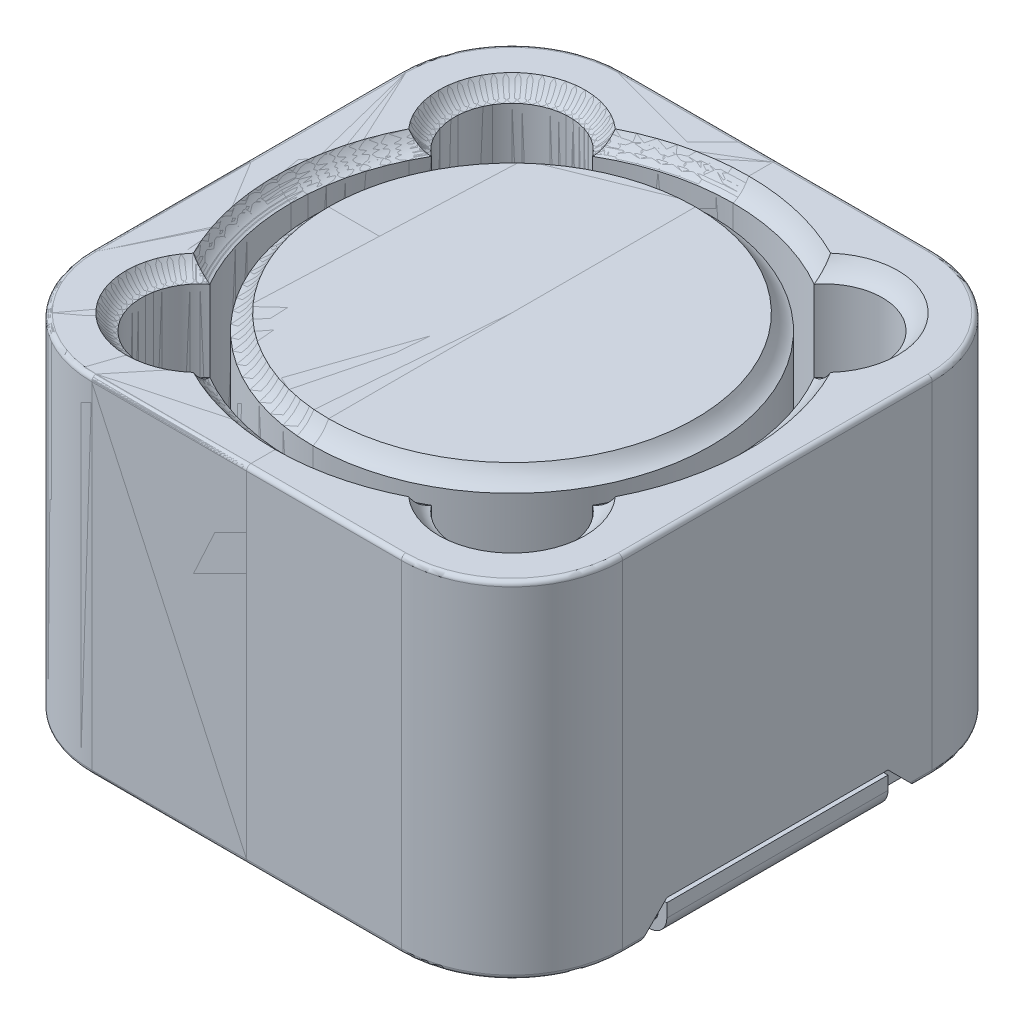
from build123d import *

# Parameters (mm, degrees)
EXTRUDE_1_DEPTH               = 7.8
CUT_EXTRUDE_2_DEPTH           = 5
CUT_REVOLVE_2_ANGLE           = 61
CUT_REVOLVE_2_OTHER_WAY_ANGLE = 154
FILLET_1_R                    = 0.1
PATTERN_CIRCULAR_1_COUNT      = 4
CUT_EXTRUDE_3_DEPTH           = 0.3
EXTRUDE_4_DEPTH               = 2.5
EXTRUDE_4_DEPTH_BACK          = 2.5


with BuildPart() as part:
    # Эскиз1 → Вытянуть1 (new body)
    with BuildSketch(Plane(origin=(0, 0, 0), x_dir=(1, 0, 0), z_dir=(0, 1, 0))):
        with BuildLine():
            Line((-3.5, 6), (0, 6))
            Line((0, 6), (0, 0))
            Line((0, 0), (-6, 0))
            Line((-6, 0), (-6, 3.5))
            ThreePointArc((-6, 3.5), (-5.267766953, 5.267766953), (-3.5, 6))
        make_face()
    extrude(amount=EXTRUDE_1_DEPTH)

    # Эскиз2 → Вытянуть2 (cut)
    with BuildSketch(Plane(origin=(0, 7.8, 0), x_dir=(1, 0, 0), z_dir=(0, 1, 0))):
        with BuildLine():
            Line((0, 4.5), (0, 5))
            ThreePointArc((0, 5), (-1.296658196, 4.828941657), (-2.504594711, 4.327471009))
            ThreePointArc((-2.504594711, 4.327471009), (-4.454772721, 4.454772721), (-4.327471009, 2.504594711))
            ThreePointArc((-4.327471009, 2.504594711), (-4.828941657, 1.296658196), (-5, 0))
            Line((-5, 0), (-4.5, 0))
            ThreePointArc((-4.5, 0), (-3.181980515, 3.181980515), (0, 4.5))
        make_face()
    extrude(amount=-CUT_EXTRUDE_2_DEPTH, mode=Mode.SUBTRACT)

    # Эскиз3 → Вырез-Повернуть1 (revolve, cut)
    with BuildSketch(Plane.XY):
        with BuildLine():
            Line((-5, 7.446446609), (-5, 7.8))
            Line((-5, 7.8), (-5.353553391, 7.8))
            add(Edge.make_bspline(
                [(-5.353553391, 7.8), (-5.213388348, 7.534834957), (-5, 7.446446609)],
                knots=[0, 0, 0, 0.5, 0.5, 0.5], degree=2))
        make_face()
        with BuildLine():
            Line((-4.5, 7.446446609), (-4.5, 7.8))
            Line((-4.5, 7.8), (-4.146446609, 7.8))
            add(Edge.make_bspline(
                [(-4.146446609, 7.8), (-4.286611652, 7.534834957), (-4.5, 7.446446609)],
                knots=[0, 0, 0, 0.5, 0.5, 0.5], degree=2))
        make_face()
    revolve(axis=Axis((0, 7.8, 0), (0, -1, 0)), mode=Mode.SUBTRACT)

    # Эскиз5 → Вырез-Повернуть2 (revolve, cut)
    with BuildSketch(Plane(origin=(-3.535533906, 0, 0), x_dir=(0, 0, -1), z_dir=(1, 0, 0))):
        with BuildLine():
            Line((4.835533906, 7.8), (4.835533906, 7.446446609))
            add(Edge.make_bspline(
                [(4.835533906, 7.446446609), (4.91391663, 7.472351464), (4.982158303, 7.521243705), (5.09775396, 7.644507846), (5.146567295, 7.71938319), (5.189087297, 7.8)],
                knots=[0, 0, 0, 0, 0.5, 0.5, 1, 1, 1, 1], degree=3))
            Line((5.189087297, 7.8), (4.835533906, 7.8))
        make_face()
    revolve(axis=Axis((-3.535533906, 8.906952458, -3.535533906), (0, -1, 0)), revolution_arc=CUT_REVOLVE_2_ANGLE, mode=Mode.SUBTRACT)

    # Эскиз5 → Вырез-Повернуть2 other way (revolve, cut)
    with BuildSketch(Plane(origin=(-3.535533906, 0, 0), x_dir=(0, 0, -1), z_dir=(1, 0, 0))):
        with BuildLine():
            Line((4.835533906, 7.8), (4.835533906, 7.446446609))
            add(Edge.make_bspline(
                [(4.835533906, 7.446446609), (4.91391663, 7.472351464), (4.982158303, 7.521243705), (5.09775396, 7.644507846), (5.146567295, 7.71938319), (5.189087297, 7.8)],
                knots=[0, 0, 0, 0, 0.5, 0.5, 1, 1, 1, 1], degree=3))
            Line((5.189087297, 7.8), (4.835533906, 7.8))
        make_face()
    revolve(axis=Axis((-3.535533906, 8.906952458, -3.535533906), (0, 1, 0)), revolution_arc=CUT_REVOLVE_2_OTHER_WAY_ANGLE, mode=Mode.SUBTRACT)

    # Скругление1
    fillet_1_edges = [part.edges().sort_by_distance(p)[0] for p in [
        (-1.75, 7.8, -6),
        (-5.267766953, 7.8, -5.267766953),
        (-6, 7.8, -1.75),
        (-6, 0, -1.75),
        (-5.267766953, 0, -5.267766953),
        (-1.75, 0, -6),
    ]]
    fillet(fillet_1_edges, radius=FILLET_1_R)


with BuildPart() as pattern_circular_1_1:
    # Круговой массив1: pattern copy
    add(part.part.rotate(Axis((0, 7.8, 0), (0, -1, 0)), 1 * 360 / PATTERN_CIRCULAR_1_COUNT))


with BuildPart() as pattern_circular_1_2:
    # Круговой массив1: pattern copy
    add(part.part.rotate(Axis((0, 7.8, 0), (0, -1, 0)), 2 * 360 / PATTERN_CIRCULAR_1_COUNT))


with BuildPart() as pattern_circular_1_3:
    # Круговой массив1: pattern copy
    add(part.part.rotate(Axis((0, 7.8, 0), (0, -1, 0)), 3 * 360 / PATTERN_CIRCULAR_1_COUNT))


with BuildPart() as cut_extrude_3_tool:
    # Эскиз7 → Вытянуть3 (new body)
    with BuildSketch(Plane(origin=(6, 0, 0), x_dir=(0, 0, -1), z_dir=(1, 0, 0))):
        Polygon((-3.1, 0), (3.1, 0), (2.5, 0.6), (-2.5, 0.6), align=None)
    cut_extrude_3 = extrude(amount=-CUT_EXTRUDE_3_DEPTH)


with BuildPart() as pattern_circular_1_1_1:
    add(pattern_circular_1_1.part)

    # Вытянуть3: cut by cut_extrude_3_tool
    add(cut_extrude_3_tool.part, mode=Mode.SUBTRACT)



with BuildPart() as pattern_circular_1_2_1:
    add(pattern_circular_1_2.part)

    # Вытянуть3: cut by cut_extrude_3_tool
    add(cut_extrude_3_tool.part, mode=Mode.SUBTRACT)


with BuildPart() as mirror_1_tool:
    # Зеркальное отражение1: Вытянуть3 across plane
    add(cut_extrude_3.mirror(Plane(origin=(0, 0, 0), x_dir=(0, 0, 1), z_dir=(1, 0, 0))))


with BuildPart() as part_1:
    add(part.part)

    # Зеркальное отражение1: cut by mirror_1_tool
    add(mirror_1_tool.part, mode=Mode.SUBTRACT)


with BuildPart() as pattern_circular_1_3_1:
    add(pattern_circular_1_3.part)

    # Зеркальное отражение1: cut by mirror_1_tool
    add(mirror_1_tool.part, mode=Mode.SUBTRACT)


with BuildPart() as pattern_circular_1_1_2:
    add(pattern_circular_1_1_1.part)

    add(pattern_circular_1_2_1.part)  # Вытянуть4 merges Круговой массив1_2
    # Эскиз8 → Вытянуть4 (add, two sides: drawn at the far end of the back side and taken through both)
    with BuildSketch(Plane.XY.offset(-EXTRUDE_4_DEPTH_BACK)):
        with BuildLine():
            Line((6, 0.5), (5.8, 0.5))
            Line((5.8, 0.5), (5.8, 0.2))
            ThreePointArc((5.8, 0.2), (5.741421356, 0.058578644), (5.6, 0))
            Line((5.6, 0), (3.8, 0))
            Line((3.8, 0), (3.8, -0.2))
            Line((3.8, -0.2), (5.6, -0.2))
            ThreePointArc((5.6, -0.2), (5.882842712, -0.082842712), (6, 0.2))
            Line((6, 0.2), (6, 0.5))
        make_face()
    extrude(amount=EXTRUDE_4_DEPTH + EXTRUDE_4_DEPTH_BACK)


with BuildPart() as body_4:
    # Зеркальное отражение5: mirrored copy
    add(pattern_circular_1_1_2.part.mirror(Plane(origin=(0, 0, 0), x_dir=(0, 0, 1), z_dir=(1, 0, 0))))


solid = Compound([part_1.part, pattern_circular_1_3_1.part, pattern_circular_1_1_2.part, body_4.part])
